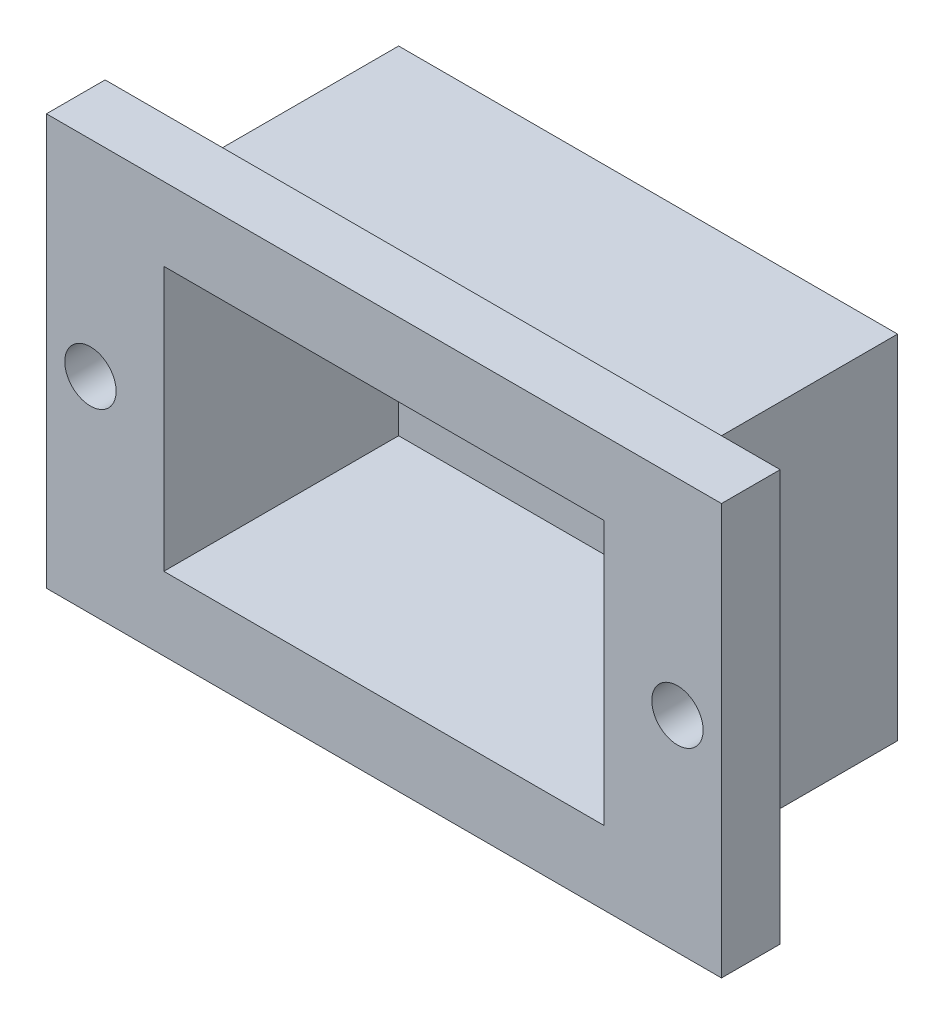
from build123d import *

# Parameters (mm, degrees)
CROQUIS1_W              = 46
CROQUIS1_H              = 28
SALIENTE_EXTRUIR1_DEPTH = 2
CROQUIS2_W              = 46
CROQUIS2_H              = 28
CROQUIS2_W_2            = 30
CROQUIS2_H_2            = 18
SALIENTE_EXTRUIR2_DEPTH = 16
CROQUIS3_R              = 1.75
AGUJEROS_DEPTH          = 18
CROQUIS5_W              = 6
CROQUIS5_H              = 14
CORTAR_BORDES_DEPTH     = 41.459856648
CROQUIS6_W              = 14
CROQUIS6_H              = 2
CORTAR_EXTRUIR3_DEPTH   = 47.043457733


with BuildPart() as part:
    # Croquis1 → Saliente-Extruir1 (new body)
    with BuildSketch(Plane.XY):
        Rectangle(CROQUIS1_W, CROQUIS1_H)
    extrude(amount=SALIENTE_EXTRUIR1_DEPTH)

    # Croquis2 → Saliente-Extruir2 (add)
    with BuildSketch(Plane.XY.offset(2)):
        Rectangle(CROQUIS2_W, CROQUIS2_H)
        Rectangle(CROQUIS2_W_2, CROQUIS2_H_2, mode=Mode.SUBTRACT)
    extrude(amount=SALIENTE_EXTRUIR2_DEPTH)

    # Croquis3 → Agujeros (cut)
    with BuildSketch(Plane(origin=(0, 0, 0), x_dir=(-1, 0, 0), z_dir=(0, 0, -1))):
        with Locations((-20, 0)):
            Circle(CROQUIS3_R)
        with Locations((20, 0)):
            Circle(CROQUIS3_R)
    extrude(amount=-AGUJEROS_DEPTH, mode=Mode.SUBTRACT)

    # Croquis5 → Cortar bordes (cut, through all)
    with BuildSketch(Plane.XZ.offset(14)):
        with Locations((-20, 7)):
            Rectangle(CROQUIS5_W, CROQUIS5_H)
        with Locations((20, 7)):
            Rectangle(CROQUIS5_W, CROQUIS5_H)
    extrude(amount=-CORTAR_BORDES_DEPTH, mode=Mode.SUBTRACT)

    # Croquis6 → Cortar-Extruir3 (cut, through all)
    with BuildSketch(Plane(origin=(17, 0, 0), x_dir=(0, 0, -1), z_dir=(1, 0, 0))):
        with Locations((-7, 13)):
            Rectangle(CROQUIS6_W, CROQUIS6_H)
        with Locations((-7, -13)):
            Rectangle(CROQUIS6_W, CROQUIS6_H)
    extrude(amount=-CORTAR_EXTRUIR3_DEPTH, mode=Mode.SUBTRACT)


solid = part.part
